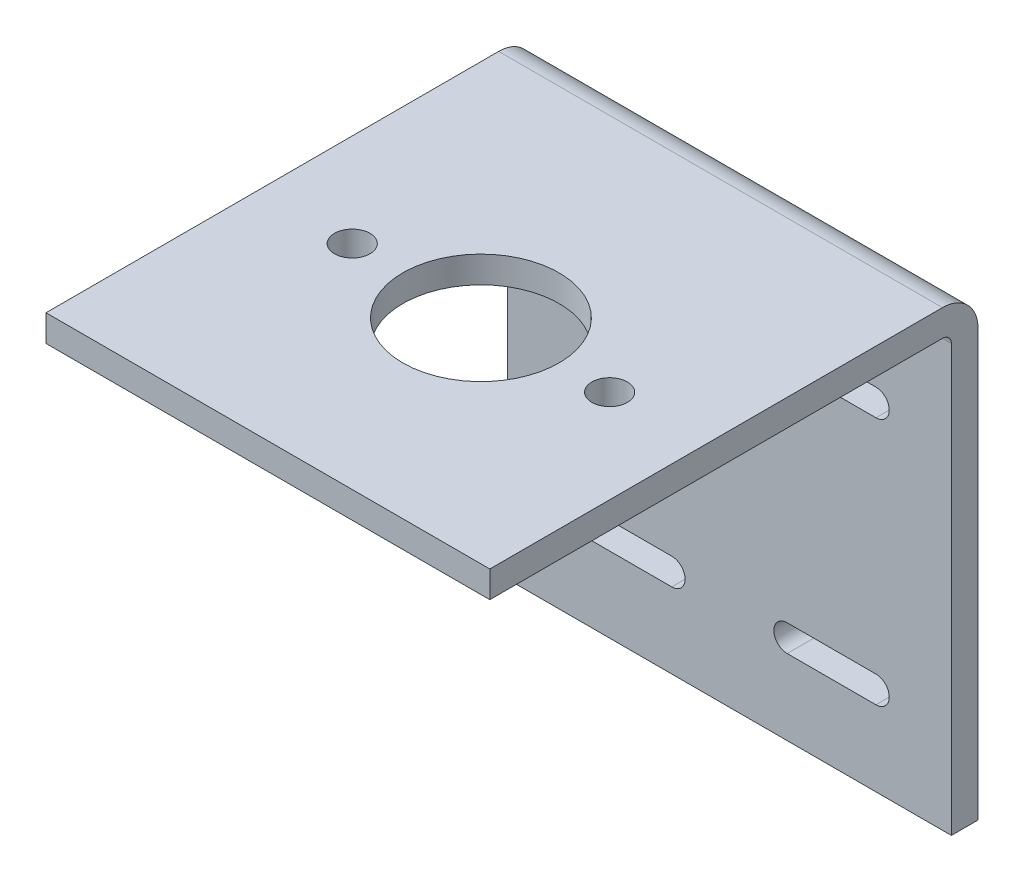
from build123d import *

# Parameters (mm, degrees)
SKETCH1_W           = 50
SKETCH1_H           = 52
BOSS_EXTRUDE1_DEPTH = 3
SKETCH2_W           = 50
SKETCH2_H           = 3
BOSS_EXTRUDE2_DEPTH = 52
FILLET1_R           = 4
FILLET2_R           = 1
CUT_EXTRUDE1_REACH  = 92.714
SKETCH3_R           = 2
SKETCH3_R_2         = 8.8
CUT_EXTRUDE2_REACH  = 90.927


with BuildPart() as part:
    # Sketch1 → Boss-Extrude1 (new body)
    with BuildSketch(Plane.XY):
        with Locations((25, 26)):
            Rectangle(SKETCH1_W, SKETCH1_H)
    extrude(amount=BOSS_EXTRUDE1_DEPTH)

    # Sketch2 → Boss-Extrude2 (add)
    with BuildSketch(Plane.XY.offset(3)):
        with Locations((25, 50.5)):
            Rectangle(SKETCH2_W, SKETCH2_H)
    extrude(amount=BOSS_EXTRUDE2_DEPTH)

    # Fillet1
    fillet1_edges = [part.edges().sort_by_distance(p)[0] for p in [
        (25, 52, 0),
    ]]
    fillet(fillet1_edges, radius=FILLET1_R)

    # Fillet2
    fillet2_edges = [part.edges().sort_by_distance(p)[0] for p in [
        (25, 49, 3),
    ]]
    fillet(fillet2_edges, radius=FILLET2_R)

    # Sketch3 → Cut-Extrude1 (cut, up to next)
    with BuildSketch(Plane(origin=(0, 52, 0), x_dir=(1, 0, 0), z_dir=(0, 1, 0)), mode=Mode.PRIVATE) as cut_extrude1_sk1:
        with Locations(Location((10.5, -31, 0), (0, 0, 270))):
            Circle(SKETCH3_R)
    cut_extrude1_tool1 = extrude(cut_extrude1_sk1.sketch, amount=-CUT_EXTRUDE1_REACH, mode=Mode.PRIVATE) & part.part
    # Sketch3 → Cut-Extrude1 (cut, up to next)
    with BuildSketch(Plane(origin=(0, 52, 0), x_dir=(1, 0, 0), z_dir=(0, 1, 0)), mode=Mode.PRIVATE) as cut_extrude1_sk2:
        with Locations(Location((39.5, -31, 0), (0, 0, 270))):
            Circle(SKETCH3_R)
    cut_extrude1_tool2 = extrude(cut_extrude1_sk2.sketch, amount=-CUT_EXTRUDE1_REACH, mode=Mode.PRIVATE) & part.part
    # Sketch3 → Cut-Extrude1 (cut, up to next)
    with BuildSketch(Plane(origin=(0, 52, 0), x_dir=(1, 0, 0), z_dir=(0, 1, 0)), mode=Mode.PRIVATE) as cut_extrude1_sk3:
        with Locations(Location((25, -31, 0), (0, 0, 270))):
            Circle(SKETCH3_R_2)
    cut_extrude1_tool3 = extrude(cut_extrude1_sk3.sketch, amount=-CUT_EXTRUDE1_REACH, mode=Mode.PRIVATE) & part.part
    add(cut_extrude1_tool1.solids().sort_by_distance((10.5, 52, 31))[0], mode=Mode.SUBTRACT)
    add(cut_extrude1_tool2.solids().sort_by_distance((39.5, 52, 31))[0], mode=Mode.SUBTRACT)
    add(cut_extrude1_tool3.solids().sort_by_distance((25, 52, 31))[0], mode=Mode.SUBTRACT)

    # Sketch6 → Cut-Extrude2 (cut, up to next)
    with BuildSketch(Plane.XY.offset(3), mode=Mode.PRIVATE) as cut_extrude2_sk1:
        with BuildLine():
            Line((8.5, 39.5), (18.5, 39.5))
            ThreePointArc((18.5, 39.5), (20, 38), (18.5, 36.5))
            Line((18.5, 36.5), (8.5, 36.5))
            ThreePointArc((8.5, 36.5), (7, 38), (8.5, 39.5))
        make_face()
    cut_extrude2_tool1 = extrude(cut_extrude2_sk1.sketch, amount=-CUT_EXTRUDE2_REACH, mode=Mode.PRIVATE) & part.part
    # Sketch6 → Cut-Extrude2 (cut, up to next)
    with BuildSketch(Plane.XY.offset(3), mode=Mode.PRIVATE) as cut_extrude2_sk2:
        with BuildLine():
            Line((41.5, 39.5), (31.5, 39.5))
            ThreePointArc((31.5, 39.5), (30, 38), (31.5, 36.5))
            Line((31.5, 36.5), (41.5, 36.5))
            ThreePointArc((41.5, 36.5), (43, 38), (41.5, 39.5))
        make_face()
    cut_extrude2_tool2 = extrude(cut_extrude2_sk2.sketch, amount=-CUT_EXTRUDE2_REACH, mode=Mode.PRIVATE) & part.part
    # Sketch6 → Cut-Extrude2 (cut, up to next)
    with BuildSketch(Plane.XY.offset(3), mode=Mode.PRIVATE) as cut_extrude2_sk3:
        with BuildLine():
            Line((8.5, 8.5), (18.5, 8.5))
            ThreePointArc((18.5, 8.5), (20, 10), (18.5, 11.5))
            Line((18.5, 11.5), (8.5, 11.5))
            ThreePointArc((8.5, 11.5), (7, 10), (8.5, 8.5))
        make_face()
    cut_extrude2_tool3 = extrude(cut_extrude2_sk3.sketch, amount=-CUT_EXTRUDE2_REACH, mode=Mode.PRIVATE) & part.part
    # Sketch6 → Cut-Extrude2 (cut, up to next)
    with BuildSketch(Plane.XY.offset(3), mode=Mode.PRIVATE) as cut_extrude2_sk4:
        with BuildLine():
            Line((41.5, 8.5), (31.5, 8.5))
            ThreePointArc((31.5, 8.5), (30, 10), (31.5, 11.5))
            Line((31.5, 11.5), (41.5, 11.5))
            ThreePointArc((41.5, 11.5), (43, 10), (41.5, 8.5))
        make_face()
    cut_extrude2_tool4 = extrude(cut_extrude2_sk4.sketch, amount=-CUT_EXTRUDE2_REACH, mode=Mode.PRIVATE) & part.part
    add(cut_extrude2_tool1.solids().sort_by_distance((13.5, 38, 3))[0], mode=Mode.SUBTRACT)
    add(cut_extrude2_tool2.solids().sort_by_distance((36.5, 38, 3))[0], mode=Mode.SUBTRACT)
    add(cut_extrude2_tool3.solids().sort_by_distance((13.5, 10, 3))[0], mode=Mode.SUBTRACT)
    add(cut_extrude2_tool4.solids().sort_by_distance((36.5, 10, 3))[0], mode=Mode.SUBTRACT)


solid = part.part
